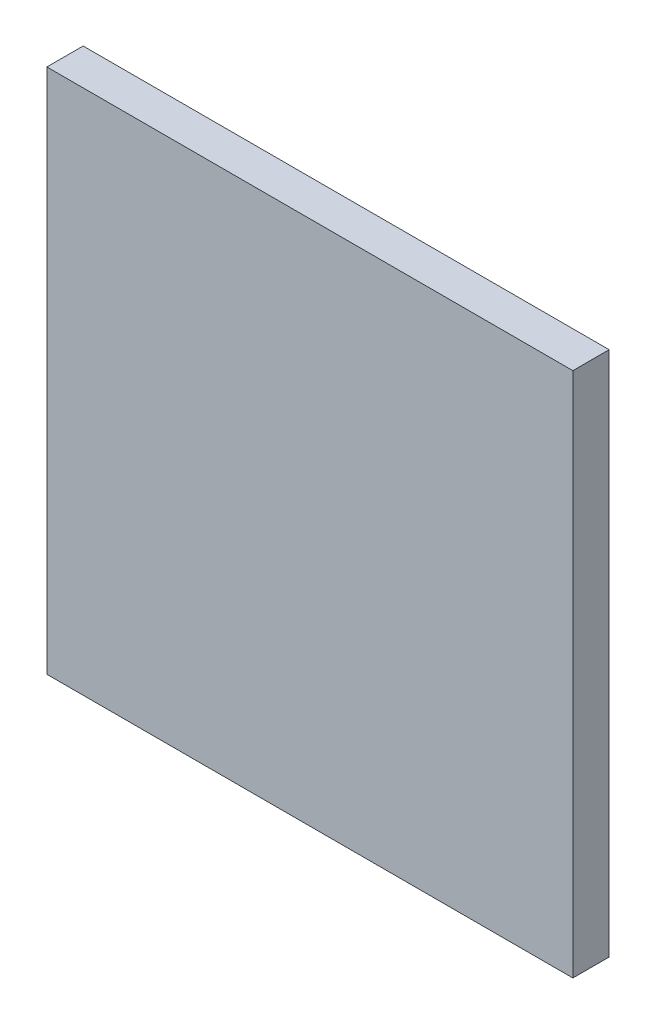
from build123d import *

# Parameters (mm, degrees)
SKETCH1_W           = 14.5
SKETCH1_H           = 14.5
BOSS_EXTRUDE1_DEPTH = 1


with BuildPart() as part:
    # Sketch1 → Boss-Extrude1 (new body)
    with BuildSketch(Plane.XY):
        with Locations((7.25, 7.25)):
            Rectangle(SKETCH1_W, SKETCH1_H)
    extrude(amount=BOSS_EXTRUDE1_DEPTH)


solid = part.part
